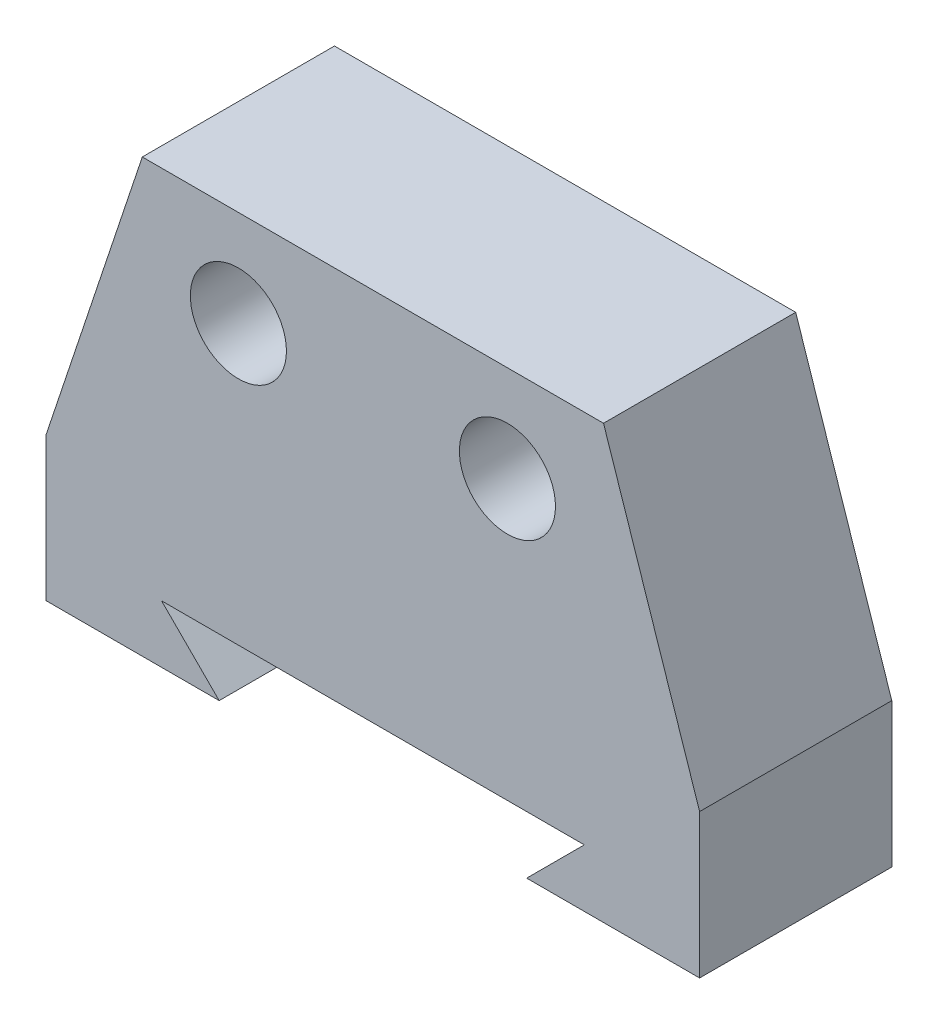
from build123d import *

# Parameters (mm, degrees)
SKETCH1_R           = 5
BOSS_EXTRUDE1_DEPTH = 10


with BuildPart() as part:
    # Sketch1 → Boss-Extrude1 (new, symmetric)
    with BuildSketch(Plane.XY):
        Polygon((-24, 39), (24, 39), (34, 9), (34, 0), (34, -6), (16, -6), (22, 0), (-22, 0), (-16, -6), (-34, -6), (-34, 0), (-34, 9), align=None)
        with Locations((-14, 29)):
            Circle(SKETCH1_R, mode=Mode.SUBTRACT)
        with Locations((14, 29)):
            Circle(SKETCH1_R, mode=Mode.SUBTRACT)
    extrude(amount=BOSS_EXTRUDE1_DEPTH, both=True)


solid = part.part
